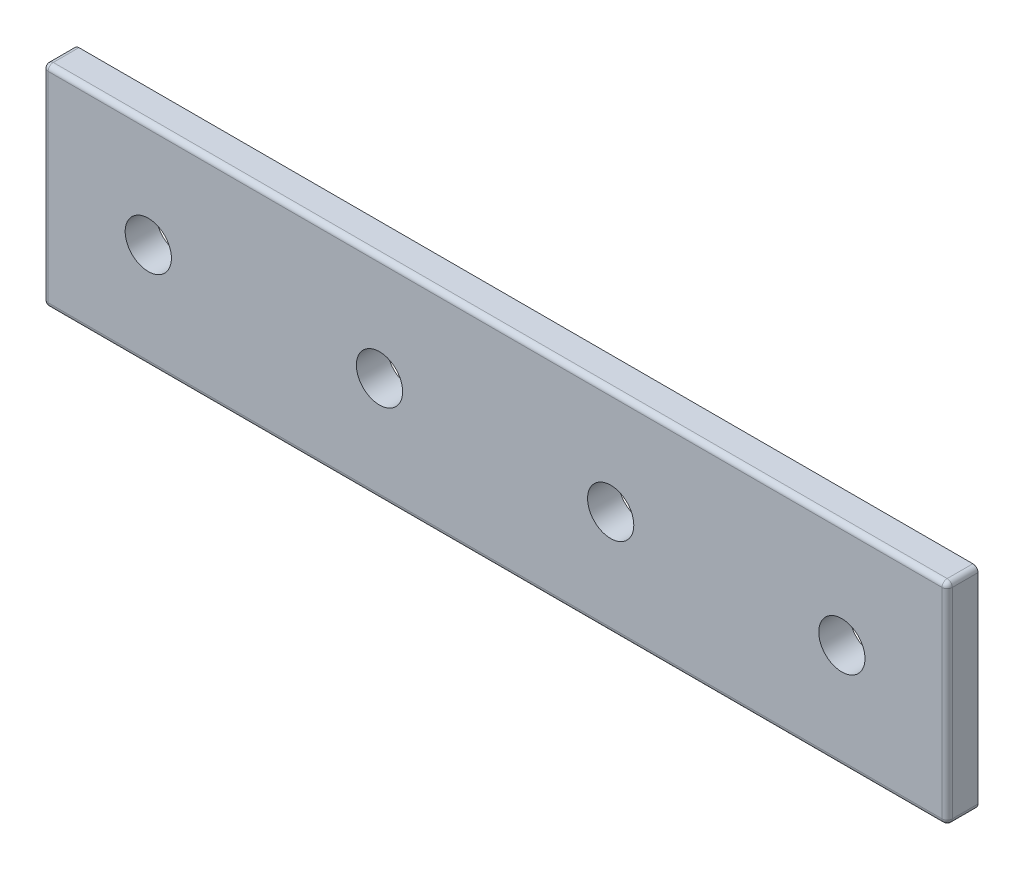
from build123d import *

# Parameters (mm, degrees)
SKETCH1_W           = 176
SKETCH1_H           = 41
SKETCH1_R           = 4.5
BOSS_EXTRUDE1_DEPTH = 3
FILLET1_R           = 1


with BuildPart() as part:
    # Sketch1 → Boss-Extrude1 (new, symmetric)
    with BuildSketch(Plane.XY):
        with Locations((88, 20.5)):
            Rectangle(SKETCH1_W, SKETCH1_H)
        with Locations((20.5, 20.5)):
            Circle(SKETCH1_R, mode=Mode.SUBTRACT)
        with Locations((65.5, 20.5)):
            Circle(SKETCH1_R, mode=Mode.SUBTRACT)
        with Locations((110.5, 20.5)):
            Circle(SKETCH1_R, mode=Mode.SUBTRACT)
        with Locations((155.5, 20.5)):
            Circle(SKETCH1_R, mode=Mode.SUBTRACT)
    extrude(amount=BOSS_EXTRUDE1_DEPTH, both=True)

    # Fillet1
    fillet1_edges = [part.edges().sort_by_distance(p)[0] for p in [
        (88, 41, 3),
        (0, 20.5, 3),
        (88, 0, 3),
        (176, 20.5, 3),
        (0, 0, 0),
        (0, 41, 0),
        (176, 41, 0),
        (176, 0, 0),
    ]]
    fillet(fillet1_edges, radius=FILLET1_R)


solid = part.part
